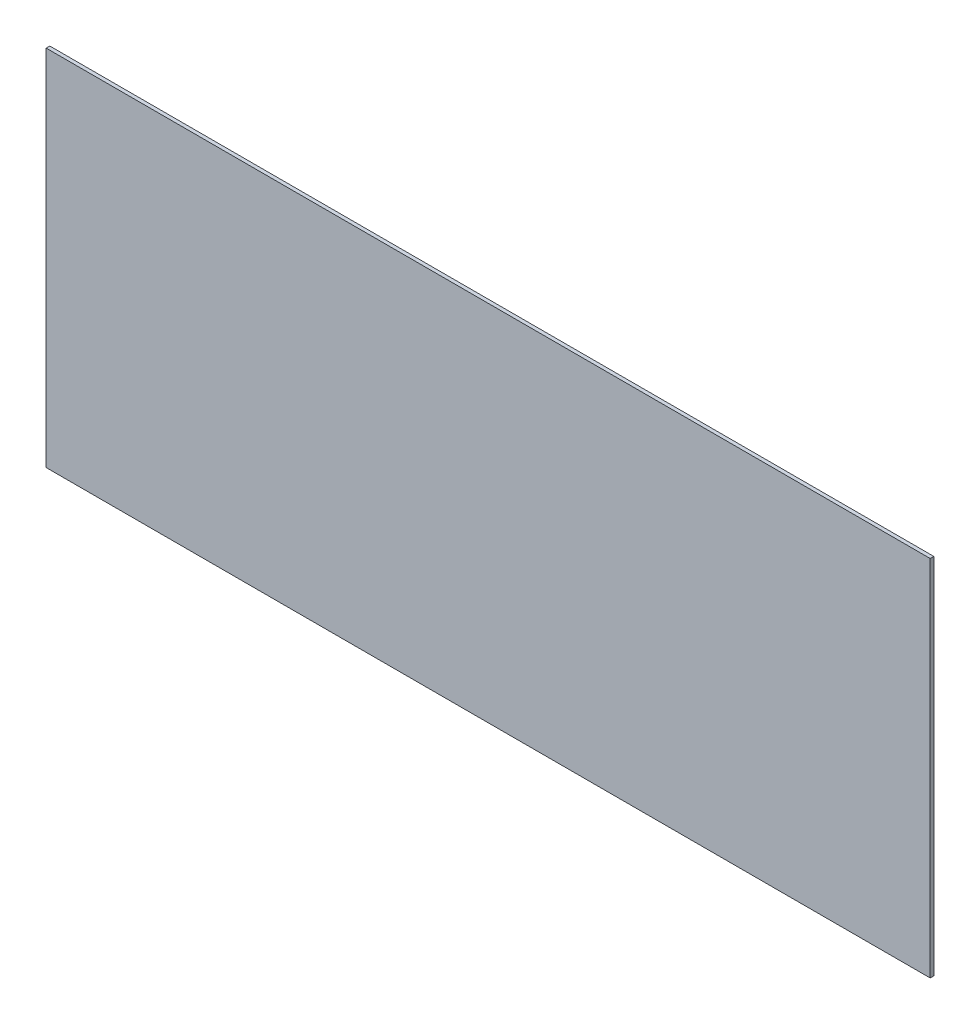
from build123d import *

# Parameters (mm, degrees)
SKETCH1_W           = 730
SKETCH1_H           = 300
BOSS_EXTRUDE1_DEPTH = 3


with BuildPart() as part:
    # Sketch1 → Boss-Extrude1 (new body)
    with BuildSketch(Plane.XY):
        with Locations((365, 150)):
            Rectangle(SKETCH1_W, SKETCH1_H)
    extrude(amount=BOSS_EXTRUDE1_DEPTH)


solid = part.part
